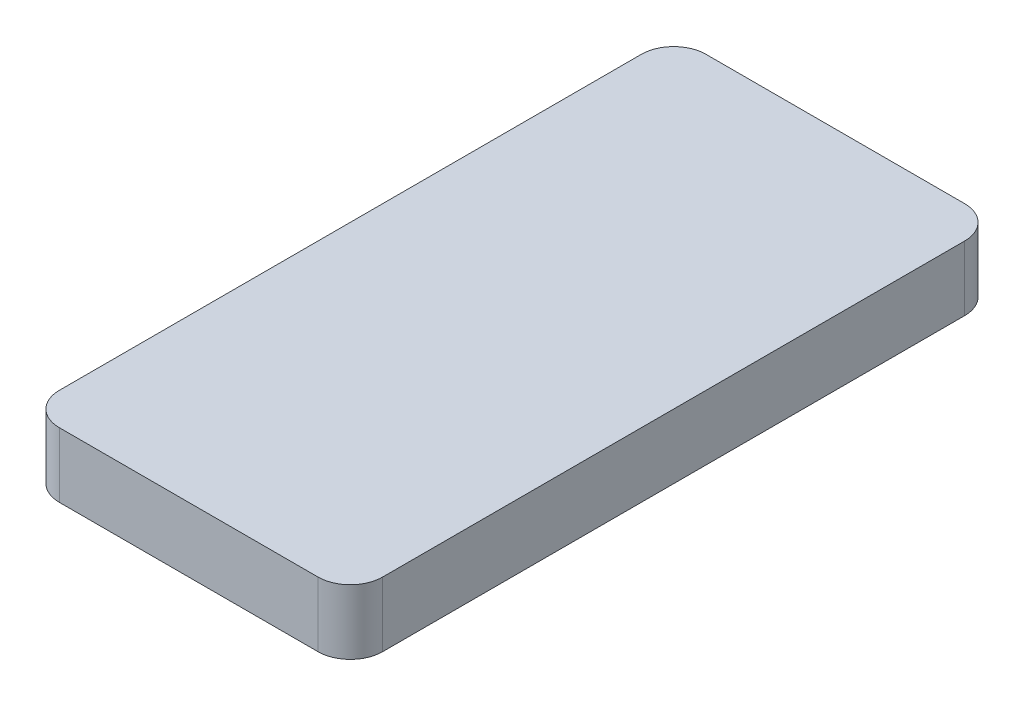
from build123d import *

# Parameters (mm, degrees)
BOSS_EXTRUDE1_DEPTH = 20


with BuildPart() as part:
    # Sketch1 → Boss-Extrude1 (new body)
    with BuildSketch(Plane(origin=(0, 0, 0), x_dir=(1, 0, 0), z_dir=(0, 1, 0))):
        with BuildLine():
            Line((-40, -100), (40, -100))
            ThreePointArc((40, -100), (47.071067812, -97.071067812), (50, -90))
            Line((50, -90), (50, 90))
            ThreePointArc((50, 90), (47.071067812, 97.071067812), (40, 100))
            Line((40, 100), (-40, 100))
            ThreePointArc((-40, 100), (-47.071067812, 97.071067812), (-50, 90))
            Line((-50, 90), (-50, -90))
            ThreePointArc((-50, -90), (-47.071067812, -97.071067812), (-40, -100))
        make_face()
    extrude(amount=BOSS_EXTRUDE1_DEPTH)


solid = part.part
